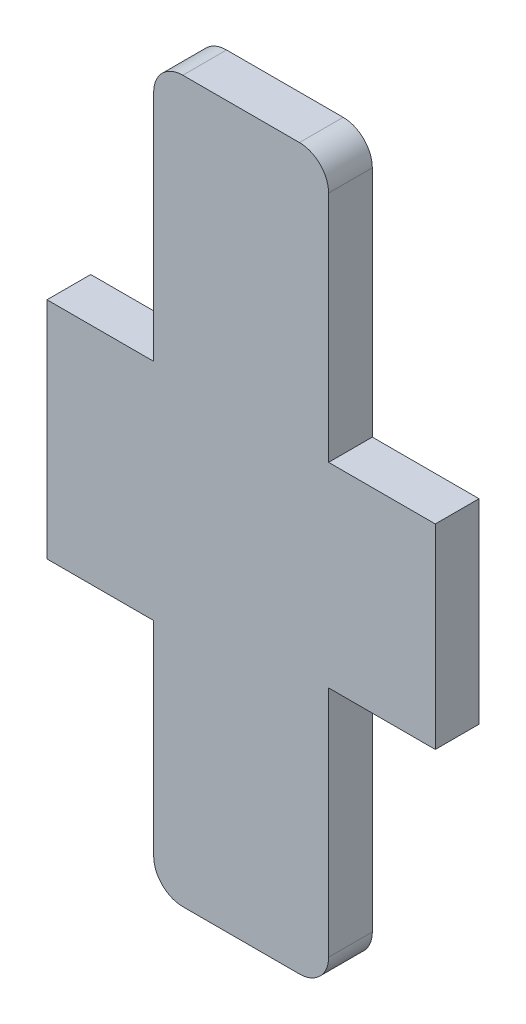
from build123d import *

# Parameters (mm, degrees)
BASE_EXTRUDE_DEPTH = 3


with BuildPart() as part:
    # Sketch1 → Base-Extrude (new body)
    with BuildSketch(Plane.XY):
        with BuildLine():
            Line((-1588.329332145, -37.365903922), (-1588.329332145, -51.365903922))
            ThreePointArc((-1588.329332145, -51.365903922), (-1587.743545707, -52.780117485), (-1586.329332145, -53.365903922))
            Line((-1586.329332145, -53.365903922), (-1578.329332145, -53.365903922))
            ThreePointArc((-1578.329332145, -53.365903922), (-1576.915118583, -52.780117485), (-1576.329332145, -51.365903922))
            Line((-1576.329332145, -51.365903922), (-1576.329332145, -35.365903922))
            Line((-1576.329332145, -35.365903922), (-1569.009666147, -35.365903922))
            Line((-1569.009666147, -35.365903922), (-1569.009666147, -21.965903922))
            Line((-1569.009666147, -21.965903922), (-1576.329332145, -21.965903922))
            Line((-1576.329332145, -21.965903922), (-1576.329332145, -5.965903922))
            ThreePointArc((-1576.329332145, -5.965903922), (-1576.915118583, -4.55169036), (-1578.329332145, -3.965903922))
            Line((-1578.329332145, -3.965903922), (-1586.329332145, -3.965903922))
            ThreePointArc((-1586.329332145, -3.965903922), (-1587.743545707, -4.55169036), (-1588.329332145, -5.965903922))
            Line((-1588.329332145, -5.965903922), (-1588.329332145, -21.965903922))
            Line((-1588.329332145, -21.965903922), (-1595.648998143, -21.965903922))
            Line((-1595.648998143, -21.965903922), (-1595.648998143, -37.365903922))
            Line((-1595.648998143, -37.365903922), (-1588.329332145, -37.365903922))
        make_face()
    extrude(amount=BASE_EXTRUDE_DEPTH)


solid = part.part
